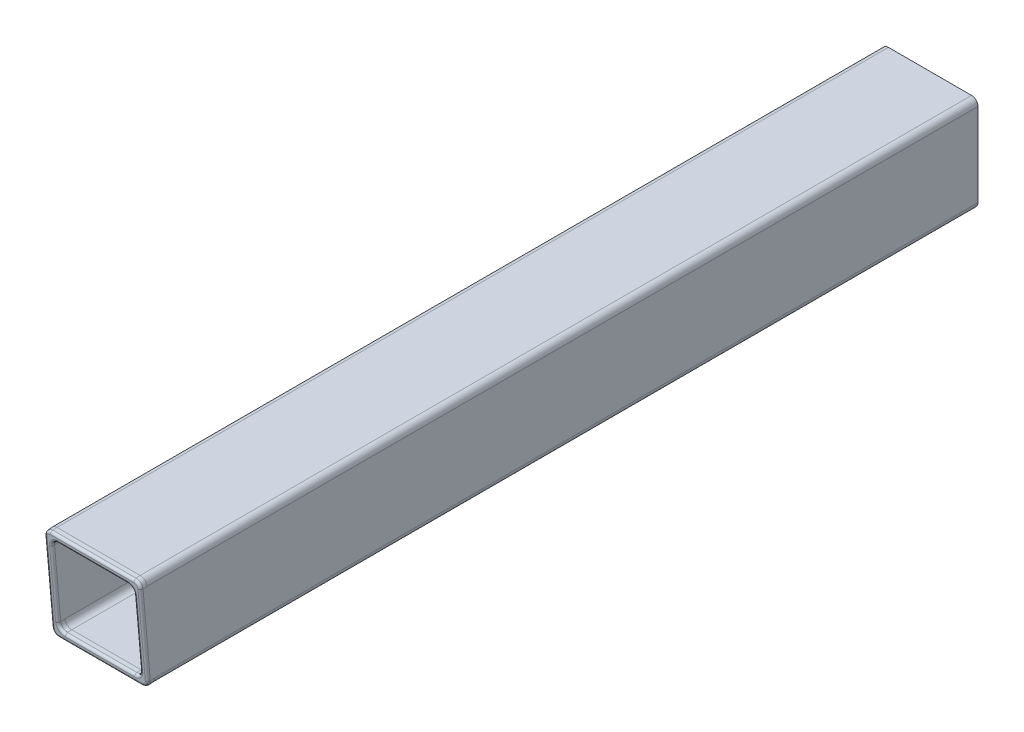
from build123d import *

# Parameters (mm, degrees)
BOSS_EXTRUDE1_DEPTH = 330
CUT_EXTRUDE1_DEPTH  = 335.369885008
BOSS_EXTRUDE2_DEPTH = 2.615348253
FILLET1_R           = 1


with BuildPart() as part:
    # Sketch1 → Boss-Extrude1 (new body)
    with BuildSketch(Plane.XY):
        with BuildLine():
            Line((2.54, 0), (35.56, 0))
            ThreePointArc((35.56, 0), (37.356051224, -0.743948776), (38.1, -2.54))
            Line((38.1, -2.54), (38.1, -35.56))
            ThreePointArc((38.1, -35.56), (37.356051224, -37.356051224), (35.56, -38.1))
            Line((35.56, -38.1), (2.54, -38.1))
            ThreePointArc((2.54, -38.1), (0.743948776, -37.356051224), (0, -35.56))
            Line((0, -35.56), (0, -2.54))
            ThreePointArc((0, -2.54), (0.743948776, -0.743948776), (2.54, 0))
        make_face()
        with BuildLine():
            Line((5.3086, -2.7686), (32.7914, -2.7686))
            ThreePointArc((32.7914, -2.7686), (34.587451224, -3.512548776), (35.3314, -5.3086))
            Line((35.3314, -5.3086), (35.3314, -32.7914))
            ThreePointArc((35.3314, -32.7914), (34.587451224, -34.587451224), (32.7914, -35.3314))
            Line((32.7914, -35.3314), (5.3086, -35.3314))
            ThreePointArc((5.3086, -35.3314), (3.512548776, -34.587451224), (2.7686, -32.7914))
            Line((2.7686, -32.7914), (2.7686, -5.3086))
            ThreePointArc((2.7686, -5.3086), (3.512548776, -3.512548776), (5.3086, -2.7686))
        make_face(mode=Mode.SUBTRACT)
    extrude(amount=BOSS_EXTRUDE1_DEPTH)

    # Sketch2 → Cut-Extrude1 (cut, through all)
    with BuildSketch(Plane(origin=(38.1, 0, 0), x_dir=(0, 0, -1), z_dir=(1, 0, 0))):
        Polygon((-330, 0), (-326.66668192, -38.1), (-330, -38.1), align=None)
    extrude(amount=-CUT_EXTRUDE1_DEPTH, mode=Mode.SUBTRACT)

    # Sketch3 → Boss-Extrude2 (add)
    with BuildSketch(Plane(origin=(0, -28.651949315, 327.493279247), x_dir=(1, 0, 0), z_dir=(0, -0.08715574274765835, 0.9961946980917457))):
        with BuildLine():
            Line((2.54, -9.484140704), (35.56, -9.484140704))
            add(Edge.make_bspline(
                [(35.56, -9.484140704), (38.1, -9.484140704), (38.1, -6.934438316)],
                knots=[0, 0, 0, 1.570796327, 1.570796327, 1.570796327], degree=2, weights=[1, 0.707106781, 1]))
            Line((38.1, -6.934438316), (38.1, 26.211692719))
            add(Edge.make_bspline(
                [(38.1, 26.211692719), (38.1, 28.761395107), (35.56, 28.761395107)],
                knots=[1.570796327, 1.570796327, 1.570796327, 3.141592654, 3.141592654, 3.141592654], degree=2, weights=[1, 0.707106781, 1]))
            Line((35.56, 28.761395107), (2.54, 28.761395107))
            add(Edge.make_bspline(
                [(2.54, 28.761395107), (0, 28.761395107), (0, 26.211692719)],
                knots=[3.141592654, 3.141592654, 3.141592654, 4.71238898, 4.71238898, 4.71238898], degree=2, weights=[1, 0.707106781, 1]))
            Line((0, 26.211692719), (0, -6.934438316))
            add(Edge.make_bspline(
                [(0, -6.934438316), (0, -9.484140704), (2.54, -9.484140704)],
                knots=[4.71238898, 4.71238898, 4.71238898, 6.283185307, 6.283185307, 6.283185307], degree=2, weights=[1, 0.707106781, 1]))
        make_face()
        with BuildLine():
            Line((35.3314, 23.432517117), (35.3314, -4.155262714))
            add(Edge.make_bspline(
                [(32.7914, -6.704965101), (35.3314, -6.704965101), (35.3314, -4.155262714)],
                knots=[0, 0, 0, 1.570796327, 1.570796327, 1.570796327], degree=2, weights=[1, 0.707106781, 1]))
            Line((32.7914, -6.704965101), (5.3086, -6.704965101))
            add(Edge.make_bspline(
                [(2.7686, -4.155262714), (2.7686, -6.704965101), (5.3086, -6.704965101)],
                knots=[4.71238898, 4.71238898, 4.71238898, 6.283185307, 6.283185307, 6.283185307], degree=2, weights=[1, 0.707106781, 1]))
            Line((2.7686, -4.155262714), (2.7686, 23.432517117))
            add(Edge.make_bspline(
                [(5.3086, 25.982219505), (2.7686, 25.982219505), (2.7686, 23.432517117)],
                knots=[3.141592654, 3.141592654, 3.141592654, 4.71238898, 4.71238898, 4.71238898], degree=2, weights=[1, 0.707106781, 1]))
            Line((5.3086, 25.982219505), (32.7914, 25.982219505))
            add(Edge.make_bspline(
                [(35.3314, 23.432517117), (35.3314, 25.982219505), (32.7914, 25.982219505)],
                knots=[1.570796327, 1.570796327, 1.570796327, 3.141592654, 3.141592654, 3.141592654], degree=2, weights=[1, 0.707106781, 1]))
        make_face(mode=Mode.SUBTRACT)
    extrude(amount=BOSS_EXTRUDE2_DEPTH)

    # Fillet1
    fillet1_edges = [part.edges().sort_by_distance(p)[0] for p in [
        (35.3314, -19.27794262, 330.938737023),
        (34.589162497, -34.813680939, 329.579536041),
        (19.05, -35.55934262, 329.514299097),
        (3.510837922, -34.813681359, 329.579536004),
        (2.7686, -19.27794262, 330.938737023),
        (3.510837503, -3.7422043, 332.297938006),
        (19.05, -2.99654262, 332.363174949),
        (34.589162078, -3.74220388, 332.297938042),
        (0, -19.27794262, 330.938737023),
        (0.742237922, -37.582281359, 329.33731489),
        (19.05, -38.32794262, 329.272077983),
        (37.357762497, -37.582280939, 329.337314927),
        (38.1, -19.27794262, 330.938737023),
        (37.357762078, -0.97360388, 332.540159156),
        (19.05, -0.22794262, 332.605396063),
        (0.742237503, -0.9736043, 332.540159119),
    ]]
    fillet(fillet1_edges, radius=FILLET1_R)


solid = part.part
